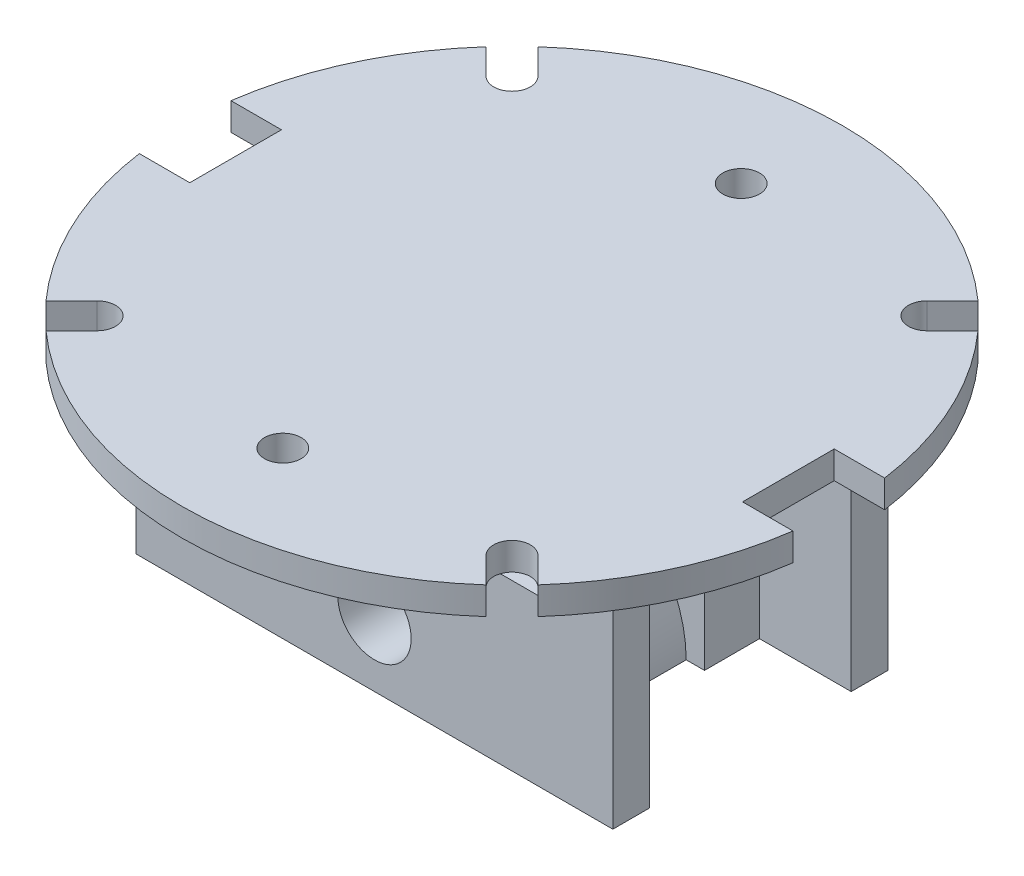
from build123d import *

# Parameters (mm, degrees)
EXTRUDE_1_DEPTH          = 12.5
CUT_EXTRUDE_1_DEPTH      = 20.532024985
CUT_EXTRUDE_1_DEPTH_BACK = 20.532024985
SKETCH_2_R               = 2
CUT_EXTRUDE_2_DEPTH      = 20.532024985
CUT_EXTRUDE_2_DEPTH_BACK = 20.532024985
CUT_EXTRUDE_START        = 12.5
SKETCH_5_W               = 16
SKETCH_5_H               = 5
CUT_EXTRUDE_4_DEPTH      = 5.5
CUT_EXTRUDE_5_DEPTH      = 2.5
CUT_EXTRUDE_5_DEPTH_BACK = 2.5
EXTRUDE_START            = 12.5
EXTRUDE_5_DEPTH          = 1.5
SKETCH_8_R               = 1
CUT_EXTRUDE_6_DEPTH      = 1.5
CUT_EXTRUDE_START_2      = 14
CUT_EXTRUDE_7_DEPTH      = 1.5


with BuildPart() as part:
    # 草图1 → 凸台-拉伸1 (new body)
    with BuildSketch(Plane(origin=(0, 0, 0), x_dir=(1, 0, 0), z_dir=(0, 1, 0))):
        Polygon((13, 5.5), (8, 5.5), (8, -5.5), (13, -5.5), (13, -7.5), (-13, -7.5), (-13, -5.5), (-8, -5.5), (-8, 5.5), (-13, 5.5), (-13, 7.5), (13, 7.5), align=None)
    extrude(amount=EXTRUDE_1_DEPTH)

    # 草图2 → 切除-拉伸1 (cut, two sides: drawn at the far end of the back side and taken through both)
    with BuildSketch(Plane.XY.offset(-CUT_EXTRUDE_1_DEPTH_BACK)):
        with Locations((0, 3.5)):
            Circle(SKETCH_2_R)
    extrude(amount=CUT_EXTRUDE_1_DEPTH + CUT_EXTRUDE_1_DEPTH_BACK, mode=Mode.SUBTRACT)

    # 草图3 → 切除-拉伸2 (cut, two sides: drawn at the far end of the back side and taken through both)
    with BuildSketch(Plane.XY.offset(-CUT_EXTRUDE_2_DEPTH_BACK)):
        with BuildLine():
            Line((-10.5, 11), (-2, 11))
            ThreePointArc((-2, 11), (-1, 10), (-2, 9))
            Line((-2, 9), (-10.5, 9))
            ThreePointArc((-10.5, 9), (-11.5, 10), (-10.5, 11))
        make_face()
        with BuildLine():
            Line((2, 9), (10.5, 9))
            ThreePointArc((10.5, 9), (11.5, 10), (10.5, 11))
            Line((10.5, 11), (2, 11))
            ThreePointArc((2, 11), (1, 10), (2, 9))
        make_face()
    extrude(amount=CUT_EXTRUDE_2_DEPTH + CUT_EXTRUDE_2_DEPTH_BACK, mode=Mode.SUBTRACT)

    # 草图5 → 切除-拉伸4 (cut)
    with BuildSketch(Plane(origin=(0, 0, 0), x_dir=(1, 0, 0), z_dir=(0, 1, 0)).offset(CUT_EXTRUDE_START)):
        Rectangle(SKETCH_5_W, SKETCH_5_H)
    extrude(amount=-CUT_EXTRUDE_4_DEPTH, mode=Mode.SUBTRACT)

    # 草图6 → 切除-拉伸5 (cut, two sides: drawn at the far end of the back side and taken through both)
    with BuildSketch(Plane.XY.offset(-CUT_EXTRUDE_5_DEPTH_BACK)):
        with BuildLine():
            Line((8, 7), (0, 7))
            ThreePointArc((0, 7), (4.949747468, 4.949747468), (7, 0))
            Line((7, 0), (8, 0))
            Line((8, 0), (8, 7))
        make_face()
        with BuildLine():
            Line((-8, 7), (-8, 0))
            Line((-8, 0), (-7, 0))
            ThreePointArc((-7, 0), (-4.949747468, 4.949747468), (0, 7))
            Line((0, 7), (-8, 7))
        make_face()
    extrude(amount=CUT_EXTRUDE_5_DEPTH + CUT_EXTRUDE_5_DEPTH_BACK, mode=Mode.SUBTRACT)

    # 草图7 → 凸台-拉伸5 (add)
    with BuildSketch(Plane(origin=(0, 0, 0), x_dir=(1, 0, 0), z_dir=(0, 1, 0)).offset(EXTRUDE_START)):
        with BuildLine():
            Line((17.82554347, 2.5), (15.07554347, 2.5))
            Line((15.07554347, 2.5), (15.07554347, -2.5))
            Line((15.07554347, -2.5), (17.82554347, -2.5))
            ThreePointArc((17.82554347, -2.5), (0, -18), (-17.82554347, -2.5))
            Line((-17.82554347, -2.5), (-15.07554347, -2.5))
            Line((-15.07554347, -2.5), (-15.07554347, 2.5))
            Line((-15.07554347, 2.5), (-17.82554347, 2.5))
            ThreePointArc((-17.82554347, 2.5), (0, 18), (17.82554347, 2.5))
        make_face()
    extrude(amount=EXTRUDE_5_DEPTH)

    # 草图8 → 切除-拉伸6 (cut)
    with BuildSketch(Plane(origin=(0, 0, 0), x_dir=(1, 0, 0), z_dir=(0, 1, 0)).offset(CUT_EXTRUDE_START)):
        with Locations(Location((0, 12.5, 0), (0, 0, 270))):
            Circle(SKETCH_8_R)
        with Locations(Location((0, -12.5, 0), (0, 0, 270))):
            Circle(SKETCH_8_R)
    extrude(amount=CUT_EXTRUDE_6_DEPTH, mode=Mode.SUBTRACT)

    # 草图9 → 切除-拉伸7 (cut)
    with BuildSketch(Plane(origin=(0, 0, 0), x_dir=(1, 0, 0), z_dir=(0, 1, 0)).offset(CUT_EXTRUDE_START_2)):
        with BuildLine():
            Line((-12.02081528, 10.606601718), (-13.435028843, 12.02081528))
            ThreePointArc((-13.435028843, 12.02081528), (-13.435028843, 13.435028843), (-12.02081528, 13.435028843))
            Line((-12.02081528, 13.435028843), (-10.606601718, 12.02081528))
            ThreePointArc((-10.606601718, 12.02081528), (-10.606601718, 10.606601718), (-12.02081528, 10.606601718))
        make_face()
        with BuildLine():
            Line((10.606601718, -12.02081528), (12.02081528, -13.435028843))
            ThreePointArc((12.02081528, -13.435028843), (13.435028843, -13.435028843), (13.435028843, -12.02081528))
            Line((13.435028843, -12.02081528), (12.02081528, -10.606601718))
            ThreePointArc((12.02081528, -10.606601718), (10.606601718, -10.606601718), (10.606601718, -12.02081528))
        make_face()
        with BuildLine():
            Line((-12.02081528, -10.606601718), (-13.435028843, -12.02081528))
            ThreePointArc((-13.435028843, -12.02081528), (-13.435028843, -13.435028843), (-12.02081528, -13.435028843))
            Line((-12.02081528, -13.435028843), (-10.606601718, -12.02081528))
            ThreePointArc((-10.606601718, -12.02081528), (-10.606601718, -10.606601718), (-12.02081528, -10.606601718))
        make_face()
        with BuildLine():
            Line((10.606601718, 12.02081528), (12.02081528, 13.435028843))
            ThreePointArc((12.02081528, 13.435028843), (13.435028843, 13.435028843), (13.435028843, 12.02081528))
            Line((13.435028843, 12.02081528), (12.02081528, 10.606601718))
            ThreePointArc((12.02081528, 10.606601718), (10.606601718, 10.606601718), (10.606601718, 12.02081528))
        make_face()
    extrude(amount=-CUT_EXTRUDE_7_DEPTH, mode=Mode.SUBTRACT)


solid = part.part
